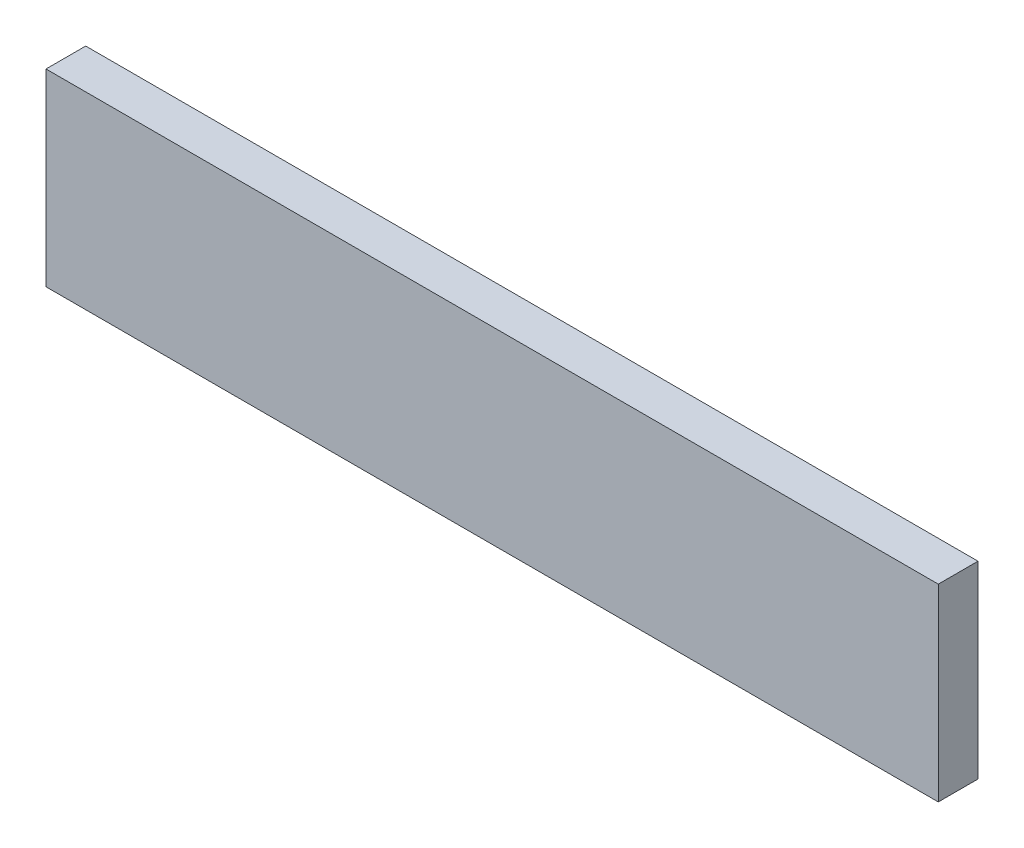
from build123d import *

# Parameters (mm, degrees)
EXTRUDE_1_DEPTH = 2
SKETCH_2_W      = 1.5
SKETCH_2_H      = 12
EXTRUDE_2_DEPTH = 1
SKETCH_3_W      = 89.86690944
SKETCH_3_H      = 19
EXTRUDE_3_DEPTH = 4
SCALE_1_SCALE   = 1.6


with BuildPart() as part:
    # 草图1 → 凸台-拉伸1 (new body)
    with BuildSketch(Plane.XY):
        with BuildLine():
            Line((0, 7.5), (71.36690944, 7.5))
            Line((71.36690944, 7.5), (71.36690944, 6.01680195))
            Line((71.36690944, 6.01680195), (78.36690944, 6.01680195))
            Line((78.36690944, 6.01680195), (78.36690944, 7.5))
            Line((78.36690944, 7.5), (80.36690944, 7.5))
            Line((80.36690944, 7.5), (80.36690944, -7.5))
            Line((80.36690944, -7.5), (78.36690944, -7.5))
            Line((78.36690944, -7.5), (78.36690944, -6.01680195))
            Line((78.36690944, -6.01680195), (71.36690944, -6.01680195))
            Line((71.36690944, -6.01680195), (71.36690944, -7.5))
            Line((71.36690944, -7.5), (0, -7.5))
            ThreePointArc((0, -7.5), (-6.151670717, 0), (0, 7.5))
        make_face()
    extrude(amount=EXTRUDE_1_DEPTH)

    # 草图2 → 凸台-拉伸2 (add)
    with BuildSketch(Plane.XY.offset(2)):
        with Locations((3, 0)):
            Rectangle(SKETCH_2_W, SKETCH_2_H)
        with Locations((6, 0)):
            Rectangle(SKETCH_2_W, SKETCH_2_H)
        with Locations((9, 0)):
            Rectangle(SKETCH_2_W, SKETCH_2_H)
        with Locations((12, 0)):
            Rectangle(SKETCH_2_W, SKETCH_2_H)
        with Locations((15, 0)):
            Rectangle(SKETCH_2_W, SKETCH_2_H)
        with Locations((18, 0)):
            Rectangle(SKETCH_2_W, SKETCH_2_H)
        with Locations((21, 0)):
            Rectangle(SKETCH_2_W, SKETCH_2_H)
        with Locations((24, 0)):
            Rectangle(SKETCH_2_W, SKETCH_2_H)
        with Locations((27, 0)):
            Rectangle(SKETCH_2_W, SKETCH_2_H)
        with Locations((30, 0)):
            Rectangle(SKETCH_2_W, SKETCH_2_H)
        with Locations((33, 0)):
            Rectangle(SKETCH_2_W, SKETCH_2_H)
        with Locations((36, 0)):
            Rectangle(SKETCH_2_W, SKETCH_2_H)
        with Locations((39, 0)):
            Rectangle(SKETCH_2_W, SKETCH_2_H)
        with Locations((42, 0)):
            Rectangle(SKETCH_2_W, SKETCH_2_H)
        with Locations((45, 0)):
            Rectangle(SKETCH_2_W, SKETCH_2_H)
        with Locations((48, 0)):
            Rectangle(SKETCH_2_W, SKETCH_2_H)
        with Locations((51, 0)):
            Rectangle(SKETCH_2_W, SKETCH_2_H)
        with Locations((54, 0)):
            Rectangle(SKETCH_2_W, SKETCH_2_H)
        with Locations((57, 0)):
            Rectangle(SKETCH_2_W, SKETCH_2_H)
        with Locations((60, 0)):
            Rectangle(SKETCH_2_W, SKETCH_2_H)
        with Locations((63, 0)):
            Rectangle(SKETCH_2_W, SKETCH_2_H)
        with Locations((66, 0)):
            Rectangle(SKETCH_2_W, SKETCH_2_H)
        with Locations((69, 0)):
            Rectangle(SKETCH_2_W, SKETCH_2_H)
    extrude(amount=EXTRUDE_2_DEPTH)


with BuildPart() as body_2:
    # 草图3 → 凸台-拉伸3 (new body)
    with BuildSketch(Plane(origin=(0, 0, 0), x_dir=(-1, 0, 0), z_dir=(0, 0, -1))):
        with Locations((-37.43345472, 0)):
            Rectangle(SKETCH_3_W, SKETCH_3_H)
    extrude(amount=-EXTRUDE_3_DEPTH)

    # Combine 1: cut part
    add(part.part, mode=Mode.SUBTRACT)


with BuildPart() as body_2_1:
    # 缩放比例1: scaled about (37.701981545, 0, 2.588708168)
    add(body_2.part.scale(SCALE_1_SCALE).moved(Location((-22.621188927, 0, -1.553224901))))


solid = body_2_1.part
